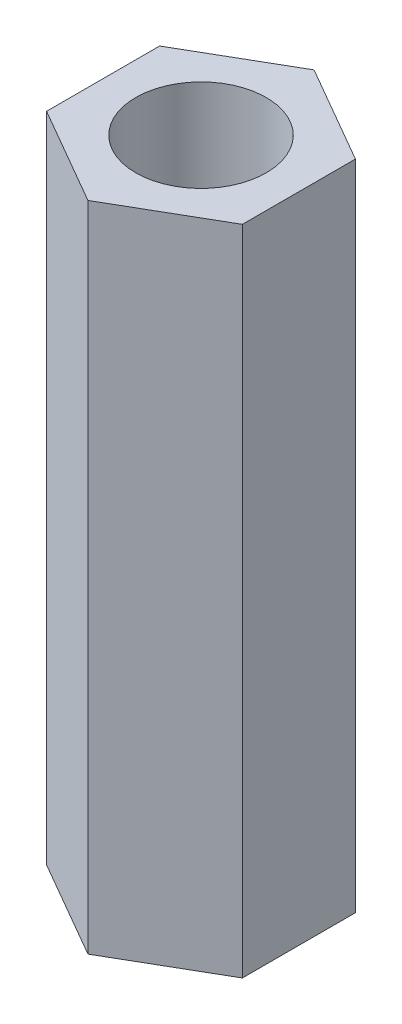
from build123d import *

# Parameters (mm, degrees)
CROQUIS1_R              = 1.5
SALIENTE_EXTRUIR1_DEPTH = 15


with BuildPart() as part:
    # Croquis1 → Saliente-Extruir1 (new body)
    with BuildSketch(Plane(origin=(0, 0, 0), x_dir=(1, 0, 0), z_dir=(0, 1, 0))):
        Polygon((0, -2.598076211), (2.25, -1.299038106), (2.25, 1.299038106), (0, 2.598076211), (-2.25, 1.299038106), (-2.25, -1.299038106), align=None)
        with Locations(Location((0, 0, 0), (0, 0, 270))):
            Circle(CROQUIS1_R, mode=Mode.SUBTRACT)
    extrude(amount=SALIENTE_EXTRUIR1_DEPTH)


solid = part.part
